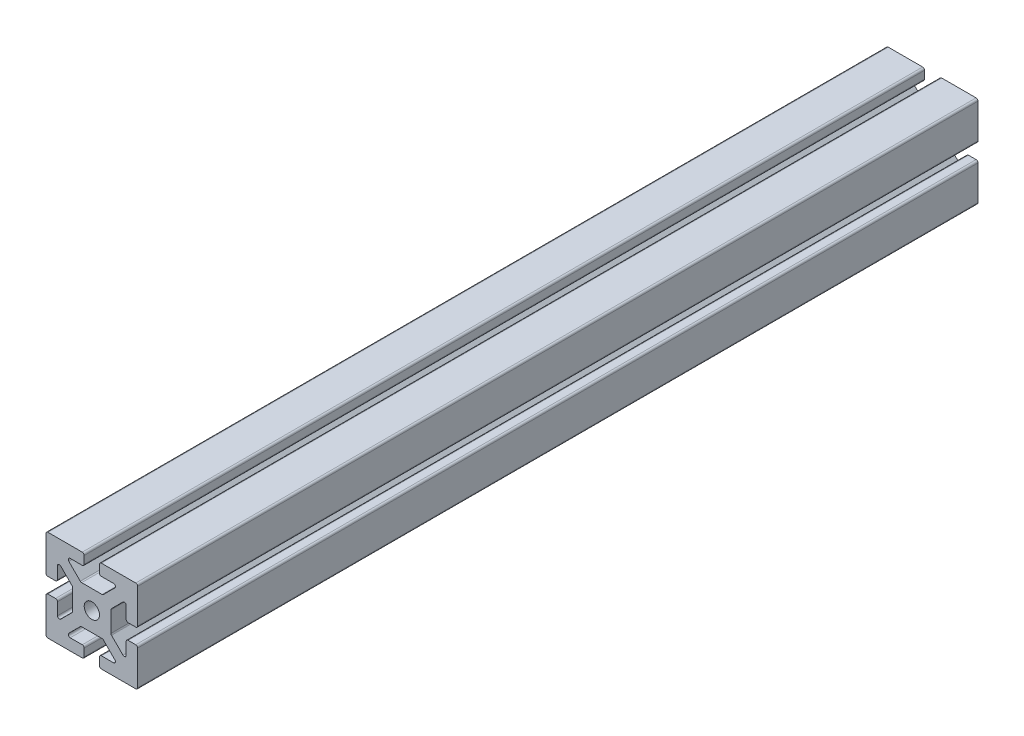
from build123d import *

# Parameters (mm, degrees)
SKETCH1_R           = 1
BOSS_EXTRUDE1_DEPTH = 110


with BuildPart() as part:
    # Sketch1 → Boss-Extrude1 (new body)
    with BuildSketch(Plane.XY):
        with BuildLine():
            Line((1.335786438, -2.5), (-1.335786438, -2.5))
            ThreePointArc((-1.335786438, -2.5), (-1.431457296, -2.519030117), (-1.512563133, -2.573223305))
            Line((-1.512563133, -2.573223305), (-3.012563133, -4.073223305))
            ThreePointArc((-3.012563133, -4.073223305), (-3.066756321, -4.345670858), (-2.835786438, -4.5))
            Line((-2.835786438, -4.5), (-1.25, -4.5))
            ThreePointArc((-1.25, -4.5), (-1.073223305, -4.573223305), (-1, -4.75))
            Line((-1, -4.75), (-1, -5.75))
            ThreePointArc((-1, -5.75), (-1.073223305, -5.926776695), (-1.25, -6))
            Line((-1.25, -6), (-5.75, -6))
            ThreePointArc((-5.75, -6), (-5.926776695, -5.926776695), (-6, -5.75))
            Line((-6, -5.75), (-6, -1.25))
            ThreePointArc((-6, -1.25), (-5.926776695, -1.073223305), (-5.75, -1))
            Line((-5.75, -1), (-4.75, -1))
            ThreePointArc((-4.75, -1), (-4.573223305, -1.073223305), (-4.5, -1.25))
            Line((-4.5, -1.25), (-4.5, -2.835786438))
            ThreePointArc((-4.5, -2.835786438), (-4.345670858, -3.066756321), (-4.073223305, -3.012563133))
            Line((-4.073223305, -3.012563133), (-2.573223305, -1.512563133))
            ThreePointArc((-2.573223305, -1.512563133), (-2.519030117, -1.431457296), (-2.5, -1.335786438))
            Line((-2.5, -1.335786438), (-2.5, 1.335786438))
            ThreePointArc((-2.5, 1.335786438), (-2.519030117, 1.431457296), (-2.573223305, 1.512563133))
            Line((-2.573223305, 1.512563133), (-4.073223305, 3.012563133))
            ThreePointArc((-4.073223305, 3.012563133), (-4.345670858, 3.066756321), (-4.5, 2.835786438))
            Line((-4.5, 2.835786438), (-4.5, 1.25))
            ThreePointArc((-4.5, 1.25), (-4.573223305, 1.073223305), (-4.75, 1))
            Line((-4.75, 1), (-5.75, 1))
            ThreePointArc((-5.75, 1), (-5.926776695, 1.073223305), (-6, 1.25))
            Line((-6, 1.25), (-6, 5.75))
            ThreePointArc((-6, 5.75), (-5.926776695, 5.926776695), (-5.75, 6))
            Line((-5.75, 6), (-1.25, 6))
            ThreePointArc((-1.25, 6), (-1.073223305, 5.926776695), (-1, 5.75))
            Line((-1, 5.75), (-1, 4.75))
            ThreePointArc((-1, 4.75), (-1.073223305, 4.573223305), (-1.25, 4.5))
            Line((-1.25, 4.5), (-2.835786438, 4.5))
            ThreePointArc((-2.835786438, 4.5), (-3.066756321, 4.345670858), (-3.012563133, 4.073223305))
            Line((-3.012563133, 4.073223305), (-1.512563133, 2.573223305))
            ThreePointArc((-1.512563133, 2.573223305), (-1.431457296, 2.519030117), (-1.335786438, 2.5))
            Line((-1.335786438, 2.5), (1.335786438, 2.5))
            ThreePointArc((1.335786438, 2.5), (1.431457296, 2.519030117), (1.512563133, 2.573223305))
            Line((1.512563133, 2.573223305), (3.012563133, 4.073223305))
            ThreePointArc((3.012563133, 4.073223305), (3.066756321, 4.345670858), (2.835786438, 4.5))
            Line((2.835786438, 4.5), (1.25, 4.5))
            ThreePointArc((1.25, 4.5), (1.073223305, 4.573223305), (1, 4.75))
            Line((1, 4.75), (1, 5.75))
            ThreePointArc((1, 5.75), (1.073223305, 5.926776695), (1.25, 6))
            Line((1.25, 6), (5.75, 6))
            ThreePointArc((5.75, 6), (5.926776695, 5.926776695), (6, 5.75))
            Line((6, 5.75), (6, 1.25))
            ThreePointArc((6, 1.25), (5.926776695, 1.073223305), (5.75, 1))
            Line((5.75, 1), (4.75, 1))
            ThreePointArc((4.75, 1), (4.573223305, 1.073223305), (4.5, 1.25))
            Line((4.5, 1.25), (4.5, 2.835786438))
            ThreePointArc((4.5, 2.835786438), (4.345670858, 3.066756321), (4.073223305, 3.012563133))
            Line((4.073223305, 3.012563133), (2.573223305, 1.512563133))
            ThreePointArc((2.573223305, 1.512563133), (2.519030117, 1.431457296), (2.5, 1.335786438))
            Line((2.5, 1.335786438), (2.5, -1.335786438))
            ThreePointArc((2.5, -1.335786438), (2.519030117, -1.431457296), (2.573223305, -1.512563133))
            Line((2.573223305, -1.512563133), (4.073223305, -3.012563133))
            ThreePointArc((4.073223305, -3.012563133), (4.345670858, -3.066756321), (4.5, -2.835786438))
            Line((4.5, -2.835786438), (4.5, -1.25))
            ThreePointArc((4.5, -1.25), (4.573223305, -1.073223305), (4.75, -1))
            Line((4.75, -1), (5.75, -1))
            ThreePointArc((5.75, -1), (5.926776695, -1.073223305), (6, -1.25))
            Line((6, -1.25), (6, -5.75))
            ThreePointArc((6, -5.75), (5.926776695, -5.926776695), (5.75, -6))
            Line((5.75, -6), (1.25, -6))
            ThreePointArc((1.25, -6), (1.073223305, -5.926776695), (1, -5.75))
            Line((1, -5.75), (1, -4.75))
            ThreePointArc((1, -4.75), (1.073223305, -4.573223305), (1.25, -4.5))
            Line((1.25, -4.5), (2.835786438, -4.5))
            ThreePointArc((2.835786438, -4.5), (3.066756321, -4.345670858), (3.012563133, -4.073223305))
            Line((3.012563133, -4.073223305), (1.512563133, -2.573223305))
            ThreePointArc((1.512563133, -2.573223305), (1.431457296, -2.519030117), (1.335786438, -2.5))
        make_face()
        Circle(SKETCH1_R, mode=Mode.SUBTRACT)
    extrude(amount=-BOSS_EXTRUDE1_DEPTH)


solid = part.part
